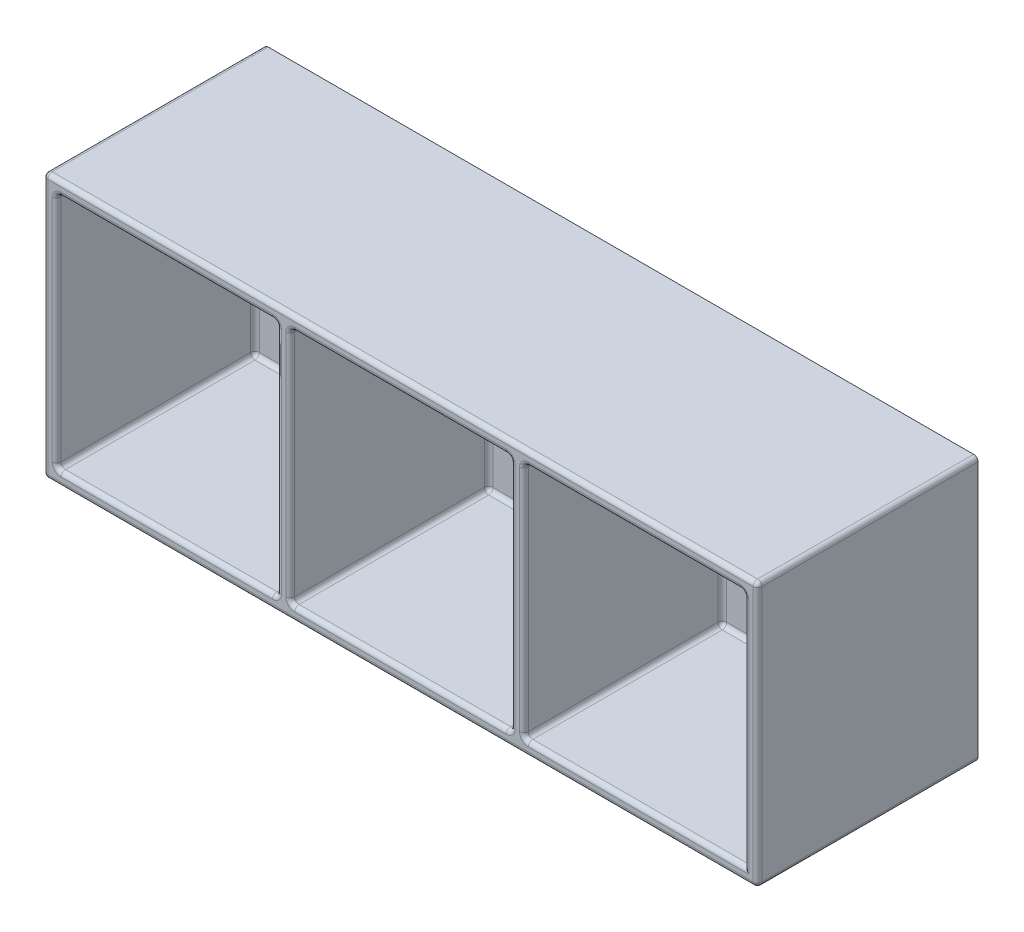
from build123d import *

# Parameters (mm, degrees)
SKETCH1_W           = 162
SKETCH1_H           = 60
BOSS_EXTRUDE1_DEPTH = 50
SKETCH2_W           = 50
SKETCH2_H           = 54
CUT_EXTRUDE1_DEPTH  = 45
FILLET1_R           = 1


with BuildPart() as part:
    # Sketch1 → Boss-Extrude1 (new body)
    with BuildSketch(Plane.XY):
        Rectangle(SKETCH1_W, SKETCH1_H)
    extrude(amount=BOSS_EXTRUDE1_DEPTH)

    # Sketch2 → Cut-Extrude1 (cut)
    with BuildSketch(Plane.XY.offset(50)):
        with Locations((-53, 0)):
            Rectangle(SKETCH2_W, SKETCH2_H)
        Rectangle(SKETCH2_W, SKETCH2_H)
        with Locations((53, 0)):
            Rectangle(SKETCH2_W, SKETCH2_H)
    extrude(amount=-CUT_EXTRUDE1_DEPTH, mode=Mode.SUBTRACT)

    # Fillet1
    fillet1_edges = [part.edges().sort_by_distance(p)[0] for p in [
        (81, 0, 50),
        (0, 30, 50),
        (-78, 0, 5),
        (-78, -27, 27.5),
        (-53, 27, 5),
        (-78, 27, 27.5),
        (-28, 0, 5),
        (-28, 27, 27.5),
        (-53, -27, 5),
        (-28, -27, 27.5),
        (-78, 0, 50),
        (-53, -27, 50),
        (-28, 0, 50),
        (-53, 27, 50),
        (-25, 0, 5),
        (-25, -27, 27.5),
        (0, 27, 5),
        (-25, 27, 27.5),
        (25, 0, 5),
        (25, 27, 27.5),
        (0, -27, 5),
        (25, -27, 27.5),
        (-25, 0, 50),
        (0, -27, 50),
        (25, 0, 50),
        (0, 27, 50),
        (28, 0, 5),
        (28, -27, 27.5),
        (53, 27, 5),
        (28, 27, 27.5),
        (78, 0, 5),
        (78, 27, 27.5),
        (53, -27, 5),
        (28, 0, 50),
        (53, -27, 50),
        (78, 0, 50),
        (53, 27, 50),
        (-81, 0, 50),
        (-81, 30, 25),
        (81, 30, 25),
        (81, -30, 25),
        (-81, -30, 25),
        (0, -30, 50),
    ]]
    fillet(fillet1_edges, radius=FILLET1_R)


solid = part.part
